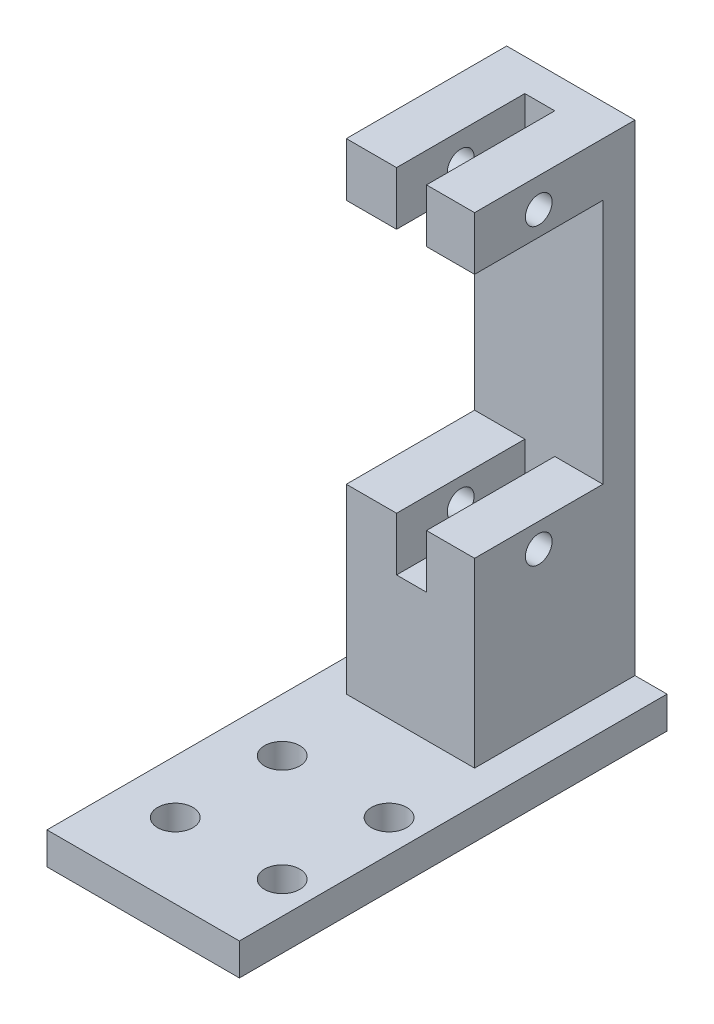
from build123d import *

# Parameters (mm, degrees)
SKETCH_1_W          = 12
SKETCH_1_H          = 40
EXTRUDE_1_DEPTH     = 3
SKETCH_2_W          = 4.5
SKETCH_2_H          = 5
SKETCH_2_W_2        = 4.7
EXTRUDE_2_DEPTH     = 12
SKETCH_3_R          = 1.25
CUT_EXTRUDE_1_DEPTH = 12
SKETCH_4_W          = 12
SKETCH_4_H          = 15
EXTRUDE_3_DEPTH     = 8
SKETCH_5_W          = 12
SKETCH_5_H          = 3
EXTRUDE_4_DEPTH     = 25
SKETCH_6_W          = 40
SKETCH_6_H          = 3
EXTRUDE_5_DEPTH     = 3
SKETCH_7_R          = 1.65
CUT_EXTRUDE_2_DEPTH = 3
SKETCH_8_W          = 40
SKETCH_8_H          = 3
EXTRUDE_6_DEPTH     = 3


with BuildPart() as part:
    # 草图1 → 凸台-拉伸1 (new body)
    with BuildSketch(Plane.XY):
        Rectangle(SKETCH_1_W, SKETCH_1_H)
    extrude(amount=EXTRUDE_1_DEPTH)

    # 草图2 → 凸台-拉伸2 (add)
    with BuildSketch(Plane.XY.offset(3)):
        with Locations((3.75, 17.5)):
            Rectangle(SKETCH_2_W, SKETCH_2_H)
        with Locations((-3.65, 17.5)):
            Rectangle(SKETCH_2_W_2, SKETCH_2_H)
        Polygon((-6, -8), (-1.3, -8), (-1.3, -13), (1.5, -13), (1.5, -8), (6, -8), (6, -20), (-6, -20), align=None)
    extrude(amount=EXTRUDE_2_DEPTH)

    # 草图3 → 切除-拉伸1 (cut)
    with BuildSketch(Plane(origin=(6, 0, 0), x_dir=(0, 0, -1), z_dir=(1, 0, 0))):
        with Locations(Location((-9, 17.25, 0), (0, 0, 90))):
            Circle(SKETCH_3_R)
        with Locations(Location((-9, -10.25, 0), (0, 0, 90))):
            Circle(SKETCH_3_R)
    extrude(amount=-CUT_EXTRUDE_1_DEPTH, mode=Mode.SUBTRACT)

    # 草图4 → 凸台-拉伸3 (add)
    with BuildSketch(Plane.XZ.offset(20)):
        with Locations((0, 7.5)):
            Rectangle(SKETCH_4_W, SKETCH_4_H)
    extrude(amount=EXTRUDE_3_DEPTH)

    # 草图5 → 凸台-拉伸4 (add)
    with BuildSketch(Plane.XY.offset(15)):
        with Locations((0, -26.5)):
            Rectangle(SKETCH_5_W, SKETCH_5_H)
    extrude(amount=EXTRUDE_4_DEPTH)

    # 草图6 → 凸台-拉伸5 (add)
    with BuildSketch(Plane(origin=(6, 0, 0), x_dir=(0, 0, -1), z_dir=(1, 0, 0))):
        with Locations((-20, -26.5)):
            Rectangle(SKETCH_6_W, SKETCH_6_H)
    extrude(amount=EXTRUDE_5_DEPTH)

    # 草图7 → 切除-拉伸2 (cut)
    with BuildSketch(Plane(origin=(0, -25, 0), x_dir=(1, 0, 0), z_dir=(0, 1, 0))):
        with Locations(Location((6, -23, 0), (0, 0, 180))):
            Circle(SKETCH_7_R)
        with Locations(Location((6, -33, 0), (0, 0, 180))):
            Circle(SKETCH_7_R)
        with Locations(Location((-4, -23, 0), (0, 0, 180))):
            Circle(SKETCH_7_R)
        with Locations(Location((-4, -33, 0), (0, 0, 180))):
            Circle(SKETCH_7_R)
    extrude(amount=-CUT_EXTRUDE_2_DEPTH, mode=Mode.SUBTRACT)

    # 草图8 → 凸台-拉伸6 (add)
    with BuildSketch(Plane.ZY.offset(6)):
        with Locations((20, -26.5)):
            Rectangle(SKETCH_8_W, SKETCH_8_H)
    extrude(amount=EXTRUDE_6_DEPTH)


solid = part.part
